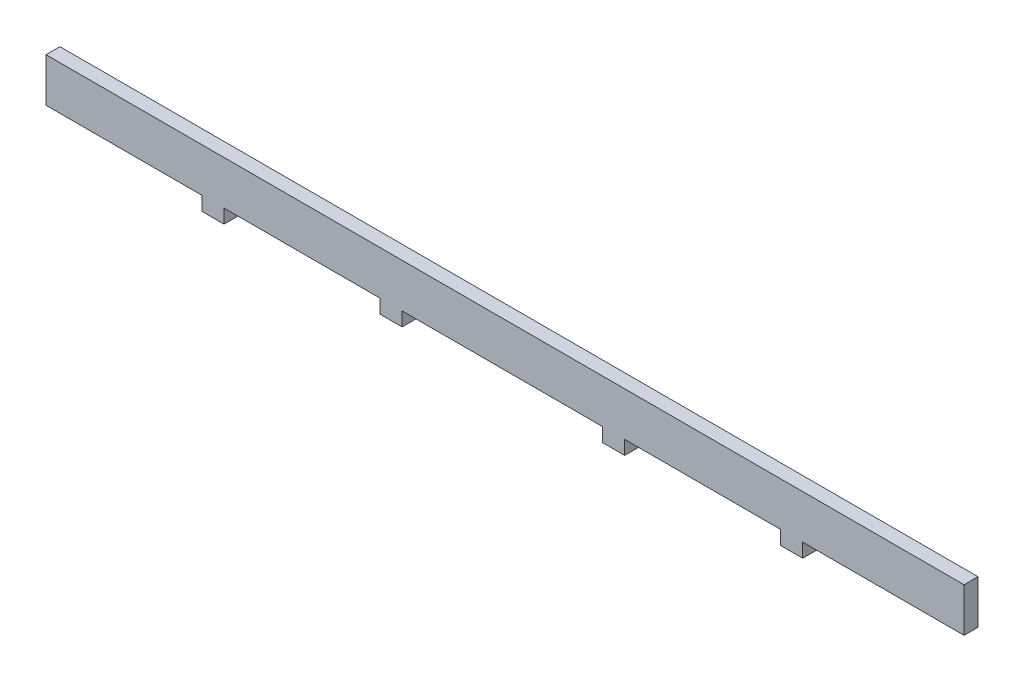
from build123d import *

# Parameters (mm, degrees)
BOSS_EXTRUDE1_DEPTH = 3.175


with BuildPart() as part:
    # Sketch1 → Boss-Extrude1 (new body)
    with BuildSketch(Plane.XY):
        Polygon((-2.267215107, 60.106814658), (-2.267215107, 56.931814658), (2.812784893, 56.931814658), (2.812784893, 60.106814658), (38.372784893, 60.106814658), (38.372784893, 56.931814658), (43.452784893, 56.931814658), (43.452784893, 60.106814658), (80.282784893, 60.106814658), (80.282784893, 70.106814658), (-129.267215107, 70.106814658), (-129.267215107, 60.106814658), (-93.707215107, 60.106814658), (-93.707215107, 56.931814658), (-88.627215107, 56.931814658), (-88.627215107, 60.106814658), (-53.067215107, 60.106814658), (-53.067215107, 56.931814658), (-47.987215107, 56.931814658), (-47.987215107, 60.106814658), align=None)
    extrude(amount=BOSS_EXTRUDE1_DEPTH)


solid = part.part
